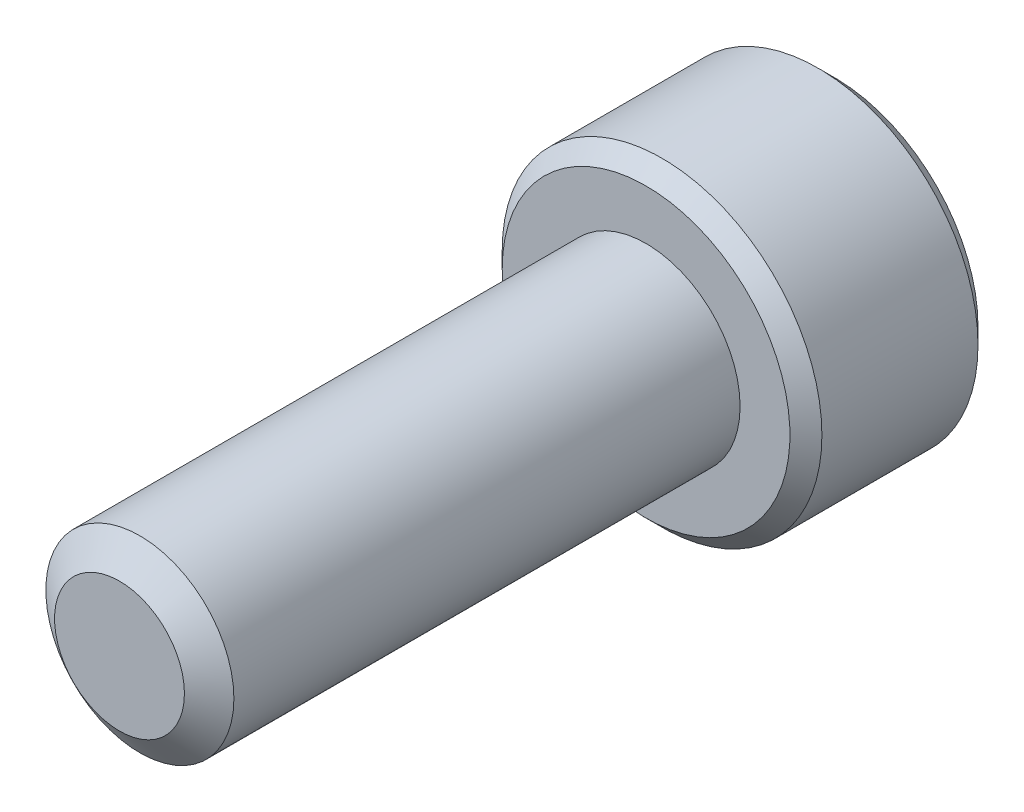
from build123d import *

# Parameters (mm, degrees)
SKETCH1_R          = 2.5
EXTRUDE1_DEPTH     = 14
SKETCH6_R          = 4.25
EXTRUDE2_DEPTH     = 5
CUT_EXTRUDE1_DEPTH = 3
CHAMFER1_SIZE      = 0.425


with BuildPart() as part:
    # Sketch1 → Extrude1 (new body)
    with BuildSketch(Plane.XY):
        Circle(SKETCH1_R)
    extrude(amount=-EXTRUDE1_DEPTH)

    # Sketch4 → Cut-Revolve1 (revolve, cut)
    with BuildSketch(Plane(origin=(0, 0, 0), x_dir=(0, 0, -1), z_dir=(1, 0, 0))):
        Polygon((0.541691224, 2.5), (0, 1.726384758), (0, 2.5), align=None)
    revolve(axis=Axis((0, 0, 0), (0, 0, -1)), mode=Mode.SUBTRACT)

    # Sketch6 → Extrude2 (add)
    with BuildSketch(Plane(origin=(0, 0, -14), x_dir=(-1, 0, 0), z_dir=(0, 0, -1))):
        Circle(SKETCH6_R)
    extrude(amount=EXTRUDE2_DEPTH)

    # Sketch7 → Cut-Extrude1 (cut)
    with BuildSketch(Plane(origin=(0, 0, -19), x_dir=(-1, 0, 0), z_dir=(0, 0, -1))):
        Polygon((0, 2.309401077), (-2, 1.154700538), (-2, -1.154700538), (0, -2.309401077), (2, -1.154700538), (2, 1.154700538), align=None)
    extrude(amount=-CUT_EXTRUDE1_DEPTH, mode=Mode.SUBTRACT)

    # Cut-Extrude2 cone 1 section (through the dimple's axis) → Cut-Extrude2 (revolve, cut)
    with BuildSketch(Plane(origin=(0, 0, -19), x_dir=(0, 1, 0), z_dir=(1, 0, 0))):
        Polygon((0, 0), (2.309401077, 0), (0, 2.309401077), align=None)
    revolve(axis=Axis((0, 0, -19), (0, 0, 1)), mode=Mode.SUBTRACT)

    # Chamfer1
    chamfer1_edges = [part.edges().sort_by_distance(p)[0] for p in [
        (4.25, 0, -19),
        (4.25, 0, -14),
    ]]
    chamfer(chamfer1_edges, length=CHAMFER1_SIZE)


solid = part.part
